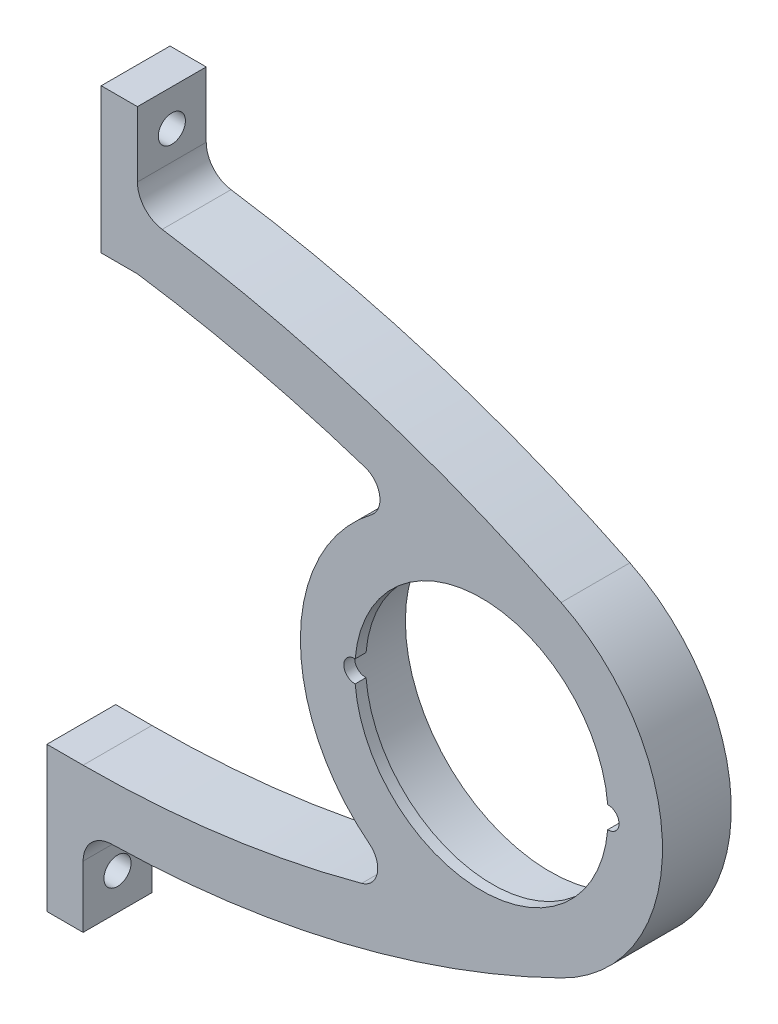
from build123d import *

# Parameters (mm, degrees)
SKETCH1_R           = 50.8
BOSS_EXTRUDE1_DEPTH = 24.13
FILLET1_R           = 10.16
FILLET3_R           = 7.62
SKETCH2_R           = 4.7625
CUT_EXTRUDE1_DEPTH  = 255.906432784
BOSS_EXTRUDE2_START = -3.81
SKETCH3_R           = 50.8
BOSS_EXTRUDE2_DEPTH = 3.81


with BuildPart() as part:
    # Sketch1 → Boss-Extrude1 (new body)
    with BuildSketch(Plane.XY):
        with BuildLine():
            Line((-133.35, 133.35), (-133.35, 82.55))
            Line((-133.35, 82.55), (-120.65, 82.55))
            ThreePointArc((-120.65, 82.55), (-72.294267859, 72.899793875), (-25.200511476, 58.285368844))
            ThreePointArc((-25.200511476, 58.285368844), (-63.5, 0), (-25.200511476, -58.285368844))
            ThreePointArc((-25.200511476, -58.285368844), (-81.753760084, -71.69426344), (-139.7, -76.2))
            Line((-139.7, -76.2), (-152.4, -76.2))
            Line((-152.4, -76.2), (-152.4, -127))
            Line((-152.4, -127), (-139.7, -127))
            Line((-139.7, -127), (-139.7, -95.25))
            ThreePointArc((-139.7, -95.25), (-53.65862904, -85.877953603), (27.94, -57.022858574))
            ThreePointArc((27.94, -57.022858574), (63.5, 0), (27.94, 57.022858574))
            ThreePointArc((27.94, 57.022858574), (-44.521647721, 85.422584161), (-120.65, 101.6))
            Line((-120.65, 101.6), (-120.65, 133.35))
            Line((-120.65, 133.35), (-133.35, 133.35))
        make_face()
        with Locations(Location((0, 0, 0), (0, 0, 180))):
            Circle(SKETCH1_R, mode=Mode.SUBTRACT)
    extrude(amount=BOSS_EXTRUDE1_DEPTH)

    # Fillet1
    fillet1_edges = [part.edges().sort_by_distance(p)[0] for p in [
        (-120.65, 101.6, 12.065),
        (-139.7, -95.25, 12.065),
    ]]
    fillet(fillet1_edges, radius=FILLET1_R)

    # Fillet3
    fillet3_edges = [part.edges().sort_by_distance(p)[0] for p in [
        (-25.200511476, -58.285368844, 12.065),
        (-25.200511476, 58.285368844, 12.065),
    ]]
    fillet(fillet3_edges, radius=FILLET3_R)

    # Sketch2 → Cut-Extrude1 (cut, through all)
    with BuildSketch(Plane.ZY.offset(152.4)):
        with Locations(Location((12.065, -114.3, 0), (0, 0, 270))):
            Circle(SKETCH2_R)
        with Locations(Location((12.065, 120.65, 0), (0, 0, 270))):
            Circle(SKETCH2_R)
    extrude(amount=-CUT_EXTRUDE1_DEPTH, mode=Mode.SUBTRACT)

    # Sketch3 → Boss-Extrude2 (add)
    with BuildSketch(Plane.XY.offset(24.13).offset(BOSS_EXTRUDE2_START)):
        with Locations(Location((0, 0, 0), (0, 0, 180))):
            Circle(SKETCH3_R)
        with BuildLine():
            ThreePointArc((-44.286714286, -3.806499412), (0, -44.45), (44.286714286, -3.806499412))
            ThreePointArc((44.286714286, -3.806499412), (48.26, 0), (44.286714286, 3.806499412))
            ThreePointArc((44.286714286, 3.806499412), (0, 44.45), (-44.286714286, 3.806499412))
            ThreePointArc((-44.286714286, 3.806499412), (-48.26, 0), (-44.286714286, -3.806499412))
        make_face(mode=Mode.SUBTRACT)
    extrude(amount=BOSS_EXTRUDE2_DEPTH)


solid = part.part
